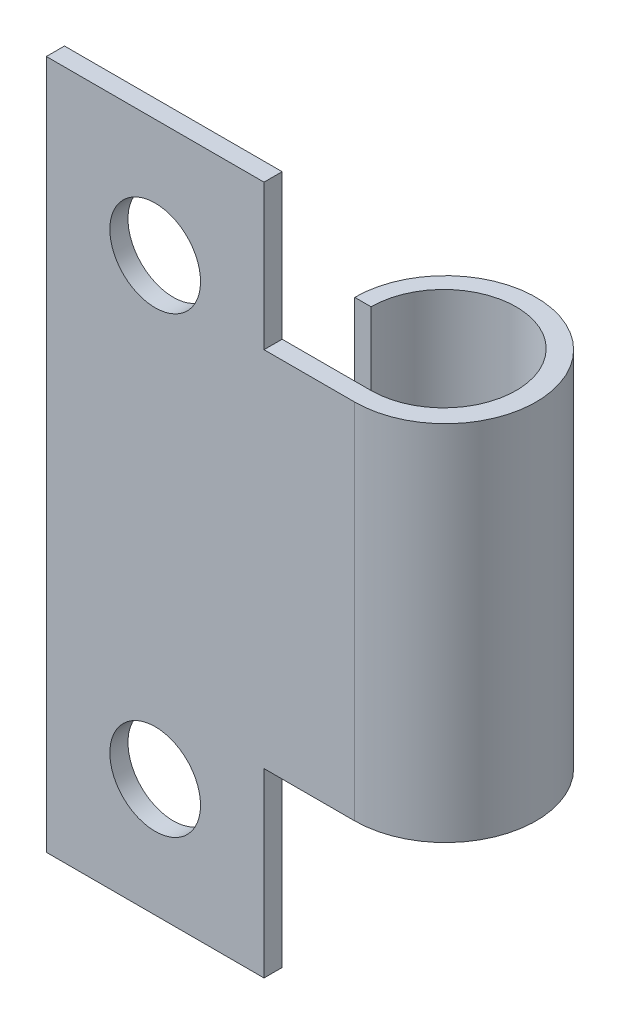
from build123d import *

# Parameters (mm, degrees)
SKETCH_1_W      = 12
SKETCH_1_H      = 38
SKETCH_1_R      = 2.5
EXTRUDE_1_DEPTH = 1
EXTRUDE_2_DEPTH = 20


with BuildPart() as part:
    # 草图1 → 凸台-拉伸1 (new body)
    with BuildSketch(Plane.XY):
        with Locations((6, 19)):
            Rectangle(SKETCH_1_W, SKETCH_1_H)
        with Locations((6, 31.5)):
            Circle(SKETCH_1_R, mode=Mode.SUBTRACT)
        with Locations((6, 6.5)):
            Circle(SKETCH_1_R, mode=Mode.SUBTRACT)
    extrude(amount=EXTRUDE_1_DEPTH)

    # 草图2 → 凸台-拉伸2 (add)
    with BuildSketch(Plane(origin=(0, 30, 0), x_dir=(1, 0, 0), z_dir=(0, 1, 0))):
        with BuildLine():
            Line((12, 0), (12, -1))
            Line((12, -1), (17, -1))
            ThreePointArc((17, -1), (20.535533906, 7.535533906), (12, 4))
            Line((12, 4), (12.902768587, 4))
            ThreePointArc((12.902768587, 4), (19.731195711, 6.828427125), (16.902768587, 0))
            Line((16.902768587, 0), (12, 0))
        make_face()
    extrude(amount=-EXTRUDE_2_DEPTH)


solid = part.part
